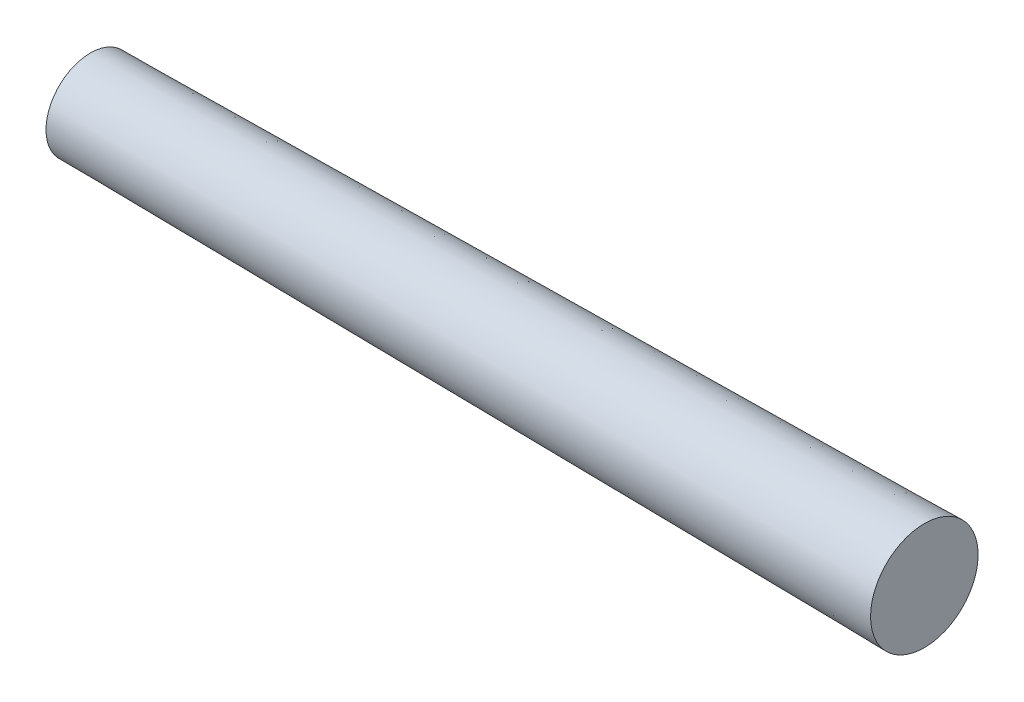
from build123d import *

# Parameters (mm, degrees)
CUT_EXTRUDE1_DEPTH      = 7.450024808
CUT_EXTRUDE1_DEPTH_BACK = 7.450024808
SKETCH2_W               = 0.493952608
SKETCH2_H               = 1.6002


with BuildPart() as part:
    # Sketch1 → Revolve1 (revolve)
    with BuildSketch(Plane.XY):
        with BuildLine():
            Line((-6.21792, 0.6604), (6.18998, 0.8001))
            ThreePointArc((6.18998, 0.8001), (6.309602756, 0.407972551), (6.35, 0))
            Line((6.35, 0), (-6.35, 0))
            ThreePointArc((-6.35, 0), (-6.316656243, 0.336739249), (-6.21792, 0.6604))
        make_face()
    revolve(axis=Axis((-6.35, 0, 0), (1, 0, 0)))

    # Sketch2 → Cut-Extrude1 (cut, two sides: drawn at the far end of the back side and taken through both)
    with BuildSketch(Plane.XY.offset(-CUT_EXTRUDE1_DEPTH_BACK)):
        with Locations((6.436956304, 0)):
            Rectangle(SKETCH2_W, SKETCH2_H)
    extrude(amount=CUT_EXTRUDE1_DEPTH + CUT_EXTRUDE1_DEPTH_BACK, mode=Mode.SUBTRACT)


solid = part.part
